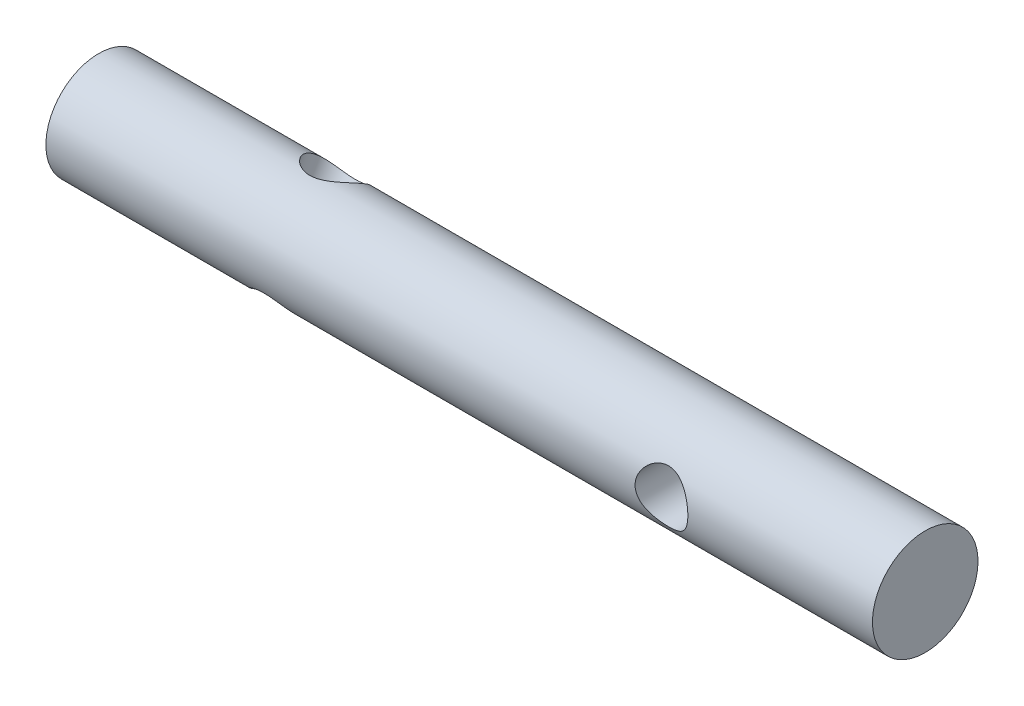
from build123d import *

# Parameters (mm, degrees)
SKETCH1_R               = 3
BOSS_EXTRUDE1_DEPTH     = 23.5
CUT_EXTRUDE1_DEPTH      = 24.879907873
CUT_EXTRUDE1_DEPTH_BACK = 24.879907873
SKETCH2_R               = 1.5
CUT_EXTRUDE2_DEPTH      = 24.879907996
CUT_EXTRUDE2_DEPTH_BACK = 24.879907996
SKETCH3_R               = 1.5


with BuildPart() as part:
    # Sketch1 → Boss-Extrude1 (new, symmetric)
    with BuildSketch(Plane.YZ):
        with Locations(Location((0, 0, 0), (0, 0, 270))):
            Circle(SKETCH1_R)
    extrude(amount=BOSS_EXTRUDE1_DEPTH, both=True)

    # Sketch2 → Cut-Extrude1 (cut, two sides: drawn at the far end of the back side and taken through both)
    with BuildSketch(Plane(origin=(0, 0, 0), x_dir=(0, 1, 0), z_dir=(0, 0, 1)).offset(-CUT_EXTRUDE1_DEPTH_BACK)):
        with Locations(Location((0, -11.5, 0), (0, 0, 270))):
            Circle(SKETCH2_R)
    extrude(amount=CUT_EXTRUDE1_DEPTH + CUT_EXTRUDE1_DEPTH_BACK, mode=Mode.SUBTRACT)

    # Sketch3 → Cut-Extrude2 (cut, two sides: drawn at the far end of the back side and taken through both)
    with BuildSketch(Plane(origin=(0, 0, 0), x_dir=(-1, 0, 0), z_dir=(0, 0.8660254037844364, -0.5000000000000041)).offset(-CUT_EXTRUDE2_DEPTH_BACK)):
        with Locations(Location((11.5, 0, 0), (0, 0, 90))):
            Circle(SKETCH3_R)
    extrude(amount=CUT_EXTRUDE2_DEPTH + CUT_EXTRUDE2_DEPTH_BACK, mode=Mode.SUBTRACT)


solid = part.part
